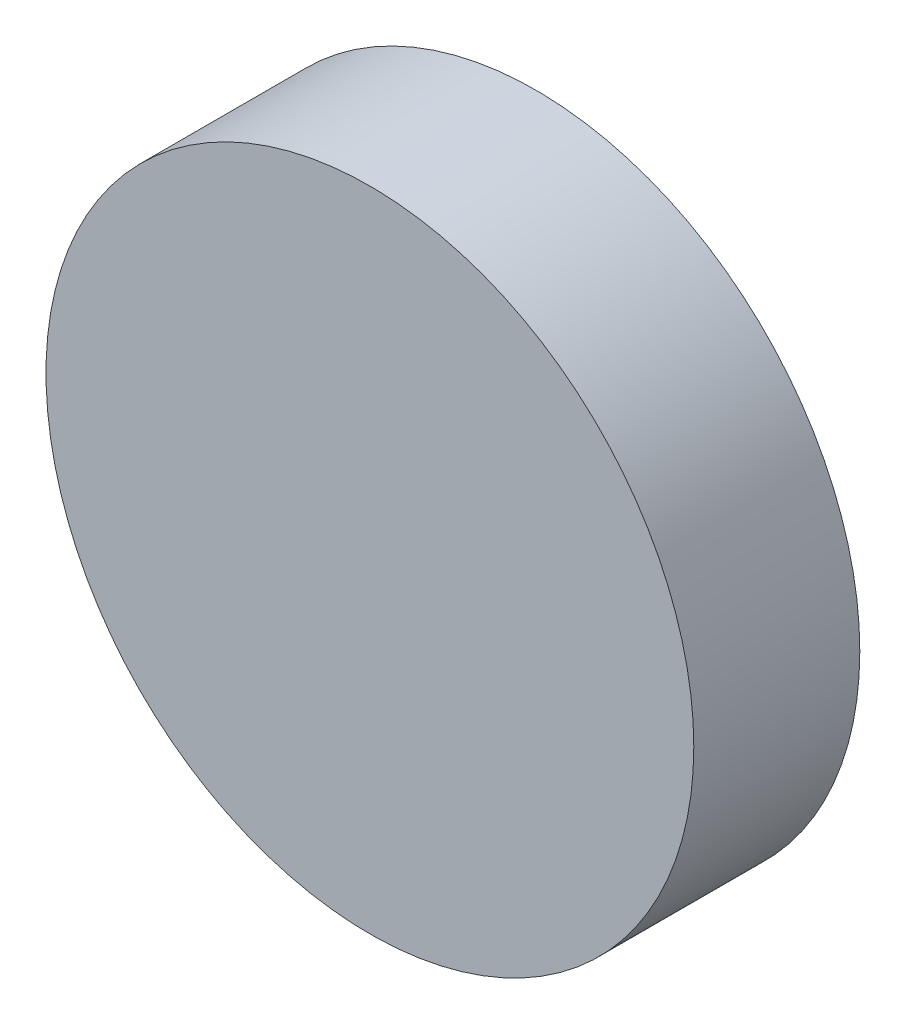
from build123d import *

# Parameters (mm, degrees)
SKETCH1_R           = 27.9
BOSS_EXTRUDE1_DEPTH = 14.3


with BuildPart() as part:
    # Sketch1 → Boss-Extrude1 (new body)
    with BuildSketch(Plane.XY):
        Circle(SKETCH1_R)
    extrude(amount=BOSS_EXTRUDE1_DEPTH)


solid = part.part
